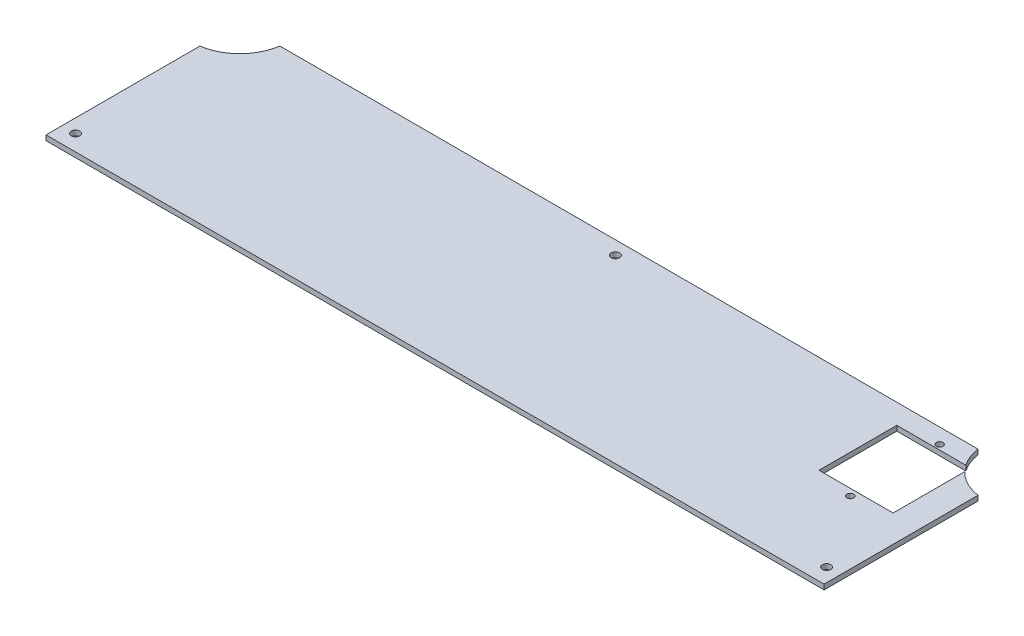
from build123d import *

# Parameters (mm, degrees)
CROQUIS1_R              = 2.5
CROQUIS1_R_2            = 2
SALIENTE_EXTRUIR1_DEPTH = 3


with BuildPart() as part:
    # Croquis1 → Saliente-Extruir1 (new body)
    with BuildSketch(Plane(origin=(0, 0, 0), x_dir=(1, 0, 0), z_dir=(0, 1, 0))):
        with BuildLine():
            Line((-230.75, -57.5), (230.75, -57.5))
            Line((230.75, -57.5), (230.75, 33.787187079))
            ThreePointArc((230.75, 33.787187079), (222.034128097, 36.553926125), (214.674528302, 41.981407938))
            Line((214.674528302, 41.981407938), (214.674528302, -0.5))
            Line((214.674528302, -0.5), (170.75, -0.5))
            Line((170.75, -0.5), (170.75, 45.629458388))
            Line((170.75, 45.629458388), (211.682145549, 45.629458388))
            ThreePointArc((211.682145549, 45.629458388), (208.675175279, 51.296886956), (207.037187079, 57.5))
            Line((207.037187079, 57.5), (-207.037187079, 57.5))
            ThreePointArc((-207.037187079, 57.5), (-214.951010127, 41.701010127), (-230.75, 33.787187079))
            Line((-230.75, 33.787187079), (-230.75, -57.5))
        make_face()
        with Locations(Location((0, 49.5, 0), (0, 0, 270))):
            Circle(CROQUIS1_R, mode=Mode.SUBTRACT)
        with Locations(Location((193.25, 48.5, 0), (0, 0, 270))):
            Circle(CROQUIS1_R_2, mode=Mode.SUBTRACT)
        with Locations(Location((193.25, -4.5, 0), (0, 0, 270))):
            Circle(CROQUIS1_R_2, mode=Mode.SUBTRACT)
        with Locations(Location((222.75, -48, 0), (0, 0, 270))):
            Circle(CROQUIS1_R, mode=Mode.SUBTRACT)
        with Locations(Location((-222.75, -48, 0), (0, 0, 270))):
            Circle(CROQUIS1_R, mode=Mode.SUBTRACT)
    extrude(amount=SALIENTE_EXTRUIR1_DEPTH)


solid = part.part
